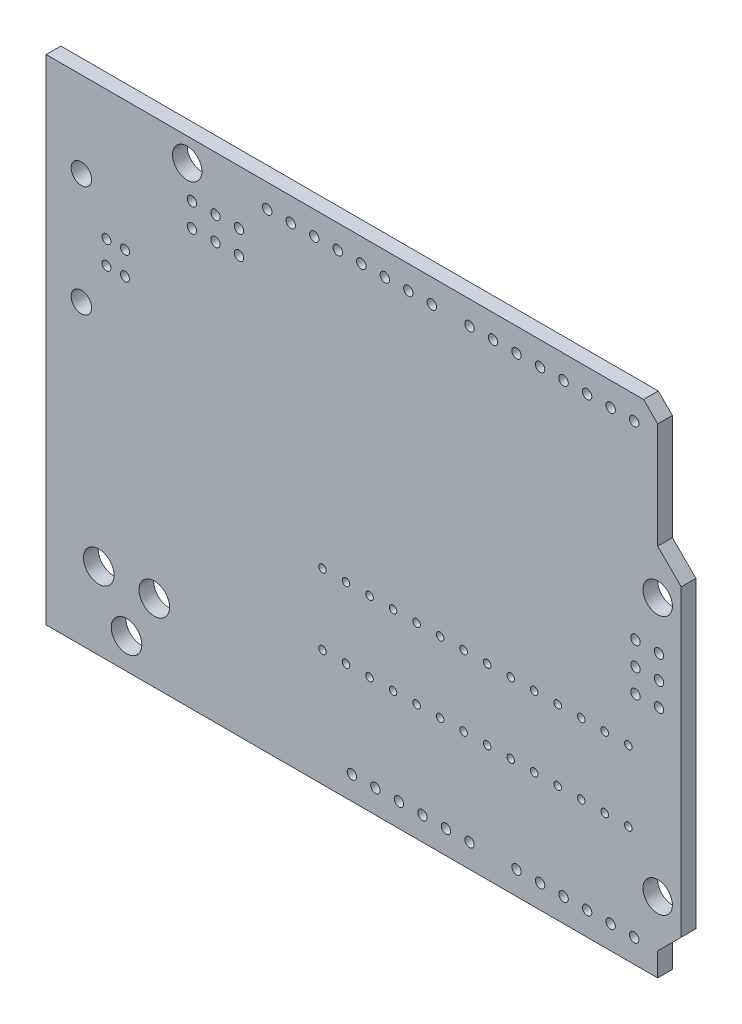
from build123d import *

# Parameters (mm, degrees)
BOSS_EXTRUDE1_DEPTH = 1.5875
SKETCH3_R           = 1.1049
SKETCH3_R_2         = 1.651
SKETCH3_R_3         = 1.5875
SKETCH3_R_4         = 0.4826
CUT_EXTRUDE1_DEPTH  = 44.469640813
SKETCH4_R           = 0.508
SKETCH4_R_2         = 0.4064
CUT_EXTRUDE2_DEPTH  = 44.469640813


with BuildPart() as part:
    # Sketch2 → Boss-Extrude1 (new body)
    with BuildSketch(Plane.XY):
        Polygon((-34.2899492, 26.67), (30.2259492, 26.67), (31.7499492, 25.146), (31.7499492, 13.716), (34.2899492, 11.176), (34.2899492, -21.59), (31.7499492, -24.13), (31.7499492, -26.67), (-34.2899492, -26.67), align=None)
    extrude(amount=-BOSS_EXTRUDE1_DEPTH)

    # Sketch3 → Cut-Extrude1 (cut, through all)
    with BuildSketch(Plane.XY):
        with Locations((-30.4799492, 17.429988)):
            Circle(SKETCH3_R)
        with Locations((-30.4799492, 5.430012)):
            Circle(SKETCH3_R)
        with Locations((-28.6003492, -18.3642)):
            Circle(SKETCH3_R_2)
        with Locations((-25.6031492, -23.368)):
            Circle(SKETCH3_R_2)
        with Locations((-22.6060508, -18.3642)):
            Circle(SKETCH3_R_2)
        with Locations((31.7499492, -19.05)):
            Circle(SKETCH3_R_3)
        with Locations((31.7499492, 8.89)):
            Circle(SKETCH3_R_3)
        with Locations((-19.0500508, 24.13)):
            Circle(SKETCH3_R_3)
        with Locations((-25.769951, 12.679934)):
            Circle(SKETCH3_R_4)
        with Locations((-27.769947, 12.679934)):
            Circle(SKETCH3_R_4)
        with Locations((-27.769947, 10.180066)):
            Circle(SKETCH3_R_4)
        with Locations((-25.769951, 10.180066)):
            Circle(SKETCH3_R_4)
    extrude(amount=-CUT_EXTRUDE1_DEPTH, mode=Mode.SUBTRACT)

    # Sketch4 → Cut-Extrude2 (cut, through all)
    with BuildSketch(Plane.XY):
        with Locations((29.2099492, 24.13)):
            Circle(SKETCH4_R)
        with Locations((26.6699492, 24.13)):
            Circle(SKETCH4_R)
        with Locations((24.1299492, 24.13)):
            Circle(SKETCH4_R)
        with Locations((21.5899492, 24.13)):
            Circle(SKETCH4_R)
        with Locations((19.0499492, 24.13)):
            Circle(SKETCH4_R)
        with Locations((16.5099492, 24.13)):
            Circle(SKETCH4_R)
        with Locations((13.9699492, 24.13)):
            Circle(SKETCH4_R)
        with Locations((11.4299492, 24.13)):
            Circle(SKETCH4_R)
        with Locations((7.3659492, 24.13)):
            Circle(SKETCH4_R)
        with Locations((4.8259492, 24.13)):
            Circle(SKETCH4_R)
        with Locations((2.2859492, 24.13)):
            Circle(SKETCH4_R)
        with Locations((-0.2540508, 24.13)):
            Circle(SKETCH4_R)
        with Locations((-2.7940508, 24.13)):
            Circle(SKETCH4_R)
        with Locations((-5.3340508, 24.13)):
            Circle(SKETCH4_R)
        with Locations((-7.8740508, 24.13)):
            Circle(SKETCH4_R)
        with Locations((-10.4140508, 24.13)):
            Circle(SKETCH4_R)
        with Locations((28.5749492, -6.477)):
            Circle(SKETCH4_R_2)
        with Locations((26.0349492, -6.477)):
            Circle(SKETCH4_R_2)
        with Locations((23.4949492, -6.477)):
            Circle(SKETCH4_R_2)
        with Locations((20.9549492, -6.477)):
            Circle(SKETCH4_R_2)
        with Locations((18.4149492, -6.477)):
            Circle(SKETCH4_R_2)
        with Locations((15.8749492, -6.477)):
            Circle(SKETCH4_R_2)
        with Locations((13.3349492, -6.477)):
            Circle(SKETCH4_R_2)
        with Locations((10.7949492, -6.477)):
            Circle(SKETCH4_R_2)
        with Locations((8.2549492, -6.477)):
            Circle(SKETCH4_R_2)
        with Locations((5.7149492, -6.477)):
            Circle(SKETCH4_R_2)
        with Locations((3.1749492, -6.477)):
            Circle(SKETCH4_R_2)
        with Locations((0.6349492, -6.477)):
            Circle(SKETCH4_R_2)
        with Locations((-1.9050508, -6.477)):
            Circle(SKETCH4_R_2)
        with Locations((-4.4450508, -6.477)):
            Circle(SKETCH4_R_2)
        with Locations((28.5749492, -14.097)):
            Circle(SKETCH4_R_2)
        with Locations((26.0349492, -14.097)):
            Circle(SKETCH4_R_2)
        with Locations((23.4949492, -14.097)):
            Circle(SKETCH4_R_2)
        with Locations((20.9549492, -14.097)):
            Circle(SKETCH4_R_2)
        with Locations((18.4149492, -14.097)):
            Circle(SKETCH4_R_2)
        with Locations((15.8749492, -14.097)):
            Circle(SKETCH4_R_2)
        with Locations((13.3349492, -14.097)):
            Circle(SKETCH4_R_2)
        with Locations((10.7949492, -14.097)):
            Circle(SKETCH4_R_2)
        with Locations((8.2549492, -14.097)):
            Circle(SKETCH4_R_2)
        with Locations((5.7149492, -14.097)):
            Circle(SKETCH4_R_2)
        with Locations((3.1749492, -14.097)):
            Circle(SKETCH4_R_2)
        with Locations((0.6349492, -14.097)):
            Circle(SKETCH4_R_2)
        with Locations((-1.9050508, -14.097)):
            Circle(SKETCH4_R_2)
        with Locations((-4.4450508, -14.097)):
            Circle(SKETCH4_R_2)
        with Locations((29.2099492, -24.13)):
            Circle(SKETCH4_R)
        with Locations((11.4299492, -24.13)):
            Circle(SKETCH4_R)
        with Locations((26.6699492, -24.13)):
            Circle(SKETCH4_R)
        with Locations((8.8899492, -24.13)):
            Circle(SKETCH4_R)
        with Locations((24.1299492, -24.13)):
            Circle(SKETCH4_R)
        with Locations((6.3499492, -24.13)):
            Circle(SKETCH4_R)
        with Locations((21.5899492, -24.13)):
            Circle(SKETCH4_R)
        with Locations((3.8099492, -24.13)):
            Circle(SKETCH4_R)
        with Locations((19.0499492, -24.13)):
            Circle(SKETCH4_R)
        with Locations((1.2699492, -24.13)):
            Circle(SKETCH4_R)
        with Locations((16.5099492, -24.13)):
            Circle(SKETCH4_R)
        with Locations((-1.2700508, -24.13)):
            Circle(SKETCH4_R)
        with Locations((-13.4620508, 20.828)):
            Circle(SKETCH4_R)
        with Locations((-13.4620508, 18.288)):
            Circle(SKETCH4_R)
        with Locations((-16.0020508, 18.288)):
            Circle(SKETCH4_R)
        with Locations((-16.0020508, 20.828)):
            Circle(SKETCH4_R)
        with Locations((-18.5420508, 18.288)):
            Circle(SKETCH4_R)
        with Locations((-18.5420508, 20.828)):
            Circle(SKETCH4_R)
        with Locations((31.8901572, -1.320038)):
            Circle(SKETCH4_R)
        with Locations((29.3501572, -1.320038)):
            Circle(SKETCH4_R)
        with Locations((29.3501572, 1.219962)):
            Circle(SKETCH4_R)
        with Locations((31.8901572, 1.219962)):
            Circle(SKETCH4_R)
        with Locations((29.3501572, 3.759962)):
            Circle(SKETCH4_R)
        with Locations((31.8901572, 3.759962)):
            Circle(SKETCH4_R)
    extrude(amount=-CUT_EXTRUDE2_DEPTH, mode=Mode.SUBTRACT)


solid = part.part
